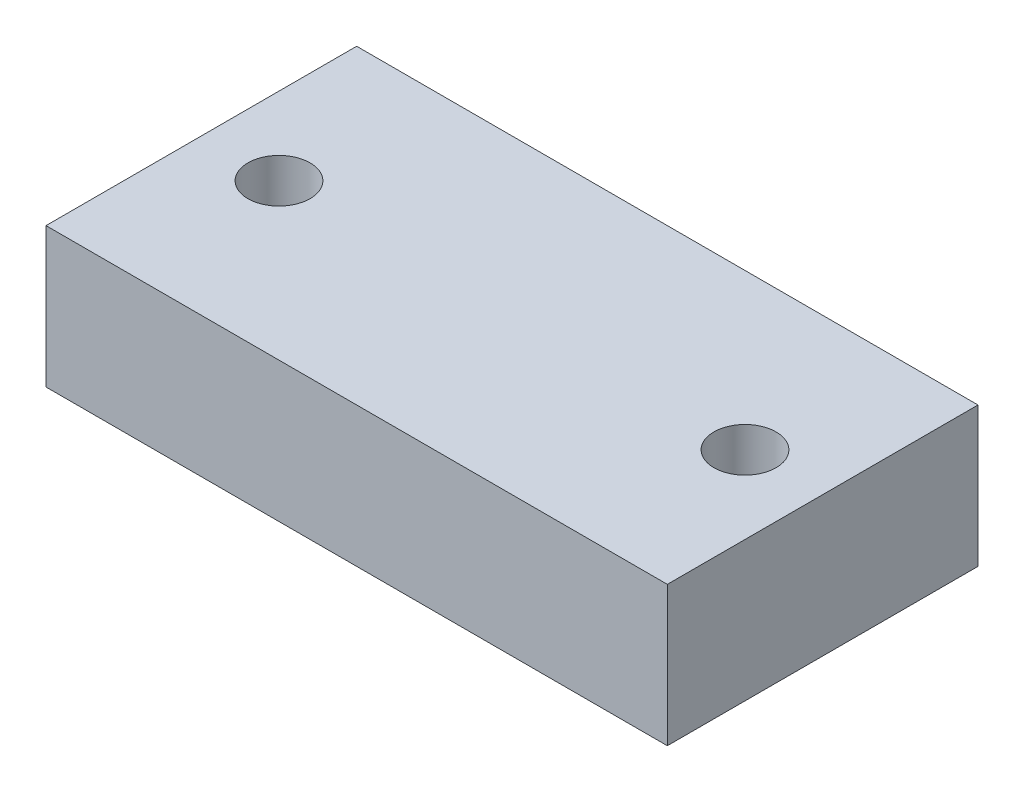
from build123d import *

# Parameters (mm, degrees)
SKETCH1_W           = 80
SKETCH1_H           = 40
SKETCH1_R           = 4
BOSS_EXTRUDE1_DEPTH = 18


with BuildPart() as part:
    # Sketch1 → Boss-Extrude1 (new body)
    with BuildSketch(Plane(origin=(0, 0, 0), x_dir=(1, 0, 0), z_dir=(0, 1, 0))):
        Rectangle(SKETCH1_W, SKETCH1_H)
        with Locations(Location((30, 0, 0), (0, 0, 270))):
            Circle(SKETCH1_R, mode=Mode.SUBTRACT)
        with Locations(Location((-30, 0, 0), (0, 0, 270))):
            Circle(SKETCH1_R, mode=Mode.SUBTRACT)
    extrude(amount=BOSS_EXTRUDE1_DEPTH)


solid = part.part
